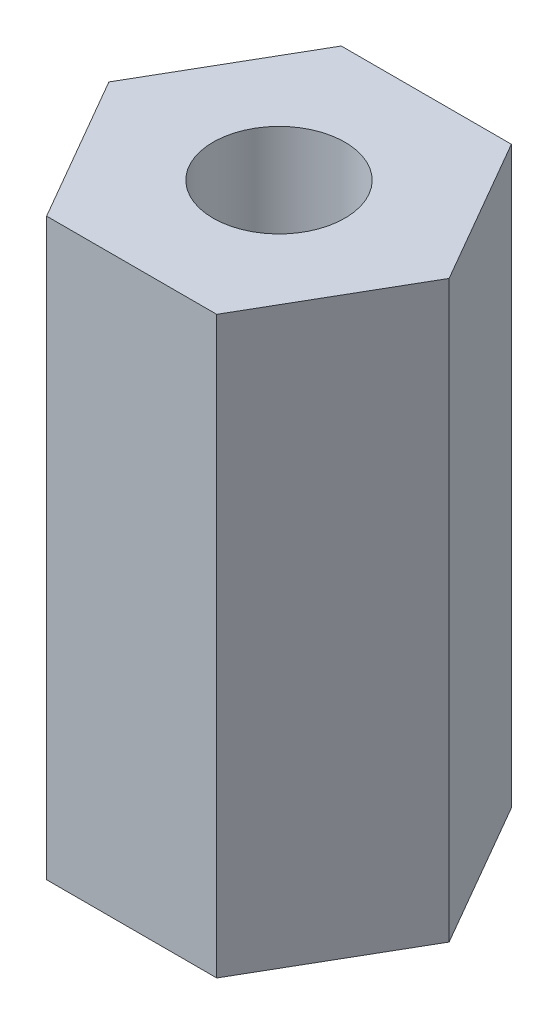
from build123d import *

# Parameters (mm, degrees)
BOSS_EXTRUDE1_DEPTH       = 10.9
M3X0_5_TAPPED_HOLE1_D     = 2.5
M3X0_5_TAPPED_HOLE1_DEPTH = 20
M3X0_5_TAPPED_HOLE1_TIP   = 0.751075774


with BuildPart() as part:
    # Sketch1 → Boss-Extrude1 (new body)
    with BuildSketch(Plane(origin=(0, 0, 0), x_dir=(1, 0, 0), z_dir=(0, 1, 0))):
        Polygon((3.226233304, 0), (1.613116652, 2.794), (-1.613116652, 2.794), (-3.226233304, 0), (-1.613116652, -2.794), (1.613116652, -2.794), align=None)
    extrude(amount=BOSS_EXTRUDE1_DEPTH)

    # M3x0.5 Tapped Hole1
    with Locations(Plane(origin=(0, 10.9, 0), x_dir=(1, 0, 0), z_dir=(0, 1, 0))):
        with Locations((0, 0)):
            Hole(M3X0_5_TAPPED_HOLE1_D / 2, depth=M3X0_5_TAPPED_HOLE1_DEPTH)
            with Locations((0, 0, -(M3X0_5_TAPPED_HOLE1_DEPTH + M3X0_5_TAPPED_HOLE1_TIP / 2))):  # 118° drill point
                Cone(0, M3X0_5_TAPPED_HOLE1_D / 2, M3X0_5_TAPPED_HOLE1_TIP, mode=Mode.SUBTRACT)


solid = part.part
